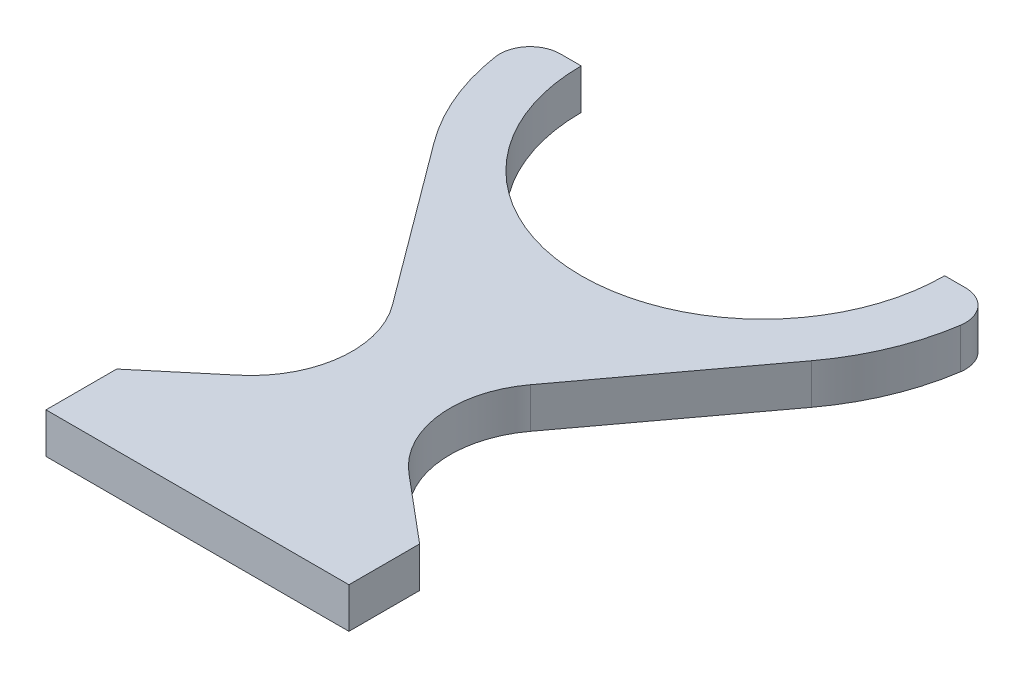
from build123d import *

# Parameters (mm, degrees)
BOSS_EXTRUDE1_DEPTH  = 20
FILLET1_R            = 50
CUT_EXTRUDE3_DEPTH   = 20
FILLET3_R            = 15
FILLET1_OF_MIRROR2_R = 50
FILLET3_OF_MIRROR2_R = 15


with BuildPart() as part:
    # Sketch1 → Boss-Extrude1 (new body)
    with BuildSketch(Plane(origin=(0, 0, 0), x_dir=(1, 0, 0), z_dir=(0, 1, 0))):
        Polygon((-75, 35), (-75, 0), (0, 0), (0, 280), (-145, 280), (-6.056000119, 92.850884872), align=None)
    boss_extrude1 = extrude(amount=BOSS_EXTRUDE1_DEPTH)

    # Fillet1
    fillet1_edges = [part.edges().sort_by_distance(p)[0] for p in [
        (-6.056000119, 10, -92.850884872),
    ]]
    fillet(fillet1_edges, radius=FILLET1_R)

    # Sketch5 → Cut-Extrude3 (cut)
    with BuildSketch(Plane(origin=(0, 20, 0), x_dir=(1, 0, 0), z_dir=(0, 1, 0))):
        with BuildLine():
            Line((0, 190), (0, 280))
            Line((0, 280), (-90, 280))
            ThreePointArc((-90, 280), (-63.639610307, 216.360389693), (0, 190))
        make_face()
        with BuildLine():
            Line((-145, 280), (-93.476414041, 210.60086417))
            ThreePointArc((-93.476414041, 210.60086417), (-110.536849713, 243.452976984), (-116.421991204, 280))
            Line((-116.421991204, 280), (-145, 280))
        make_face()
    cut_extrude3 = extrude(amount=-CUT_EXTRUDE3_DEPTH, mode=Mode.SUBTRACT)

    # Fillet3
    fillet3_edges = [part.edges().sort_by_distance(p)[0] for p in [
        (-116.421991204, 10, -280),
    ]]
    fillet(fillet3_edges, radius=FILLET3_R)

    # Mirror2: Boss-Extrude1, Cut-Extrude3 across plane
    add(boss_extrude1.mirror(Plane(origin=(0, 20, 0), x_dir=(0, 0, 1), z_dir=(-1, 0, 0))))
    add(cut_extrude3.mirror(Plane(origin=(0, 20, 0), x_dir=(0, 0, 1), z_dir=(-1, 0, 0))), mode=Mode.SUBTRACT)

    # Fillet1 of Mirror2
    fillet1_of_mirror2_edges = [part.edges().sort_by_distance(p)[0] for p in [
        (6.056000119, 10, -92.850884872),
    ]]
    fillet(fillet1_of_mirror2_edges, radius=FILLET1_OF_MIRROR2_R)

    # Fillet3 of Mirror2
    fillet3_of_mirror2_edges = [part.edges().sort_by_distance(p)[0] for p in [
        (116.421991204, 10, -280),
    ]]
    fillet(fillet3_of_mirror2_edges, radius=FILLET3_OF_MIRROR2_R)


solid = part.part
